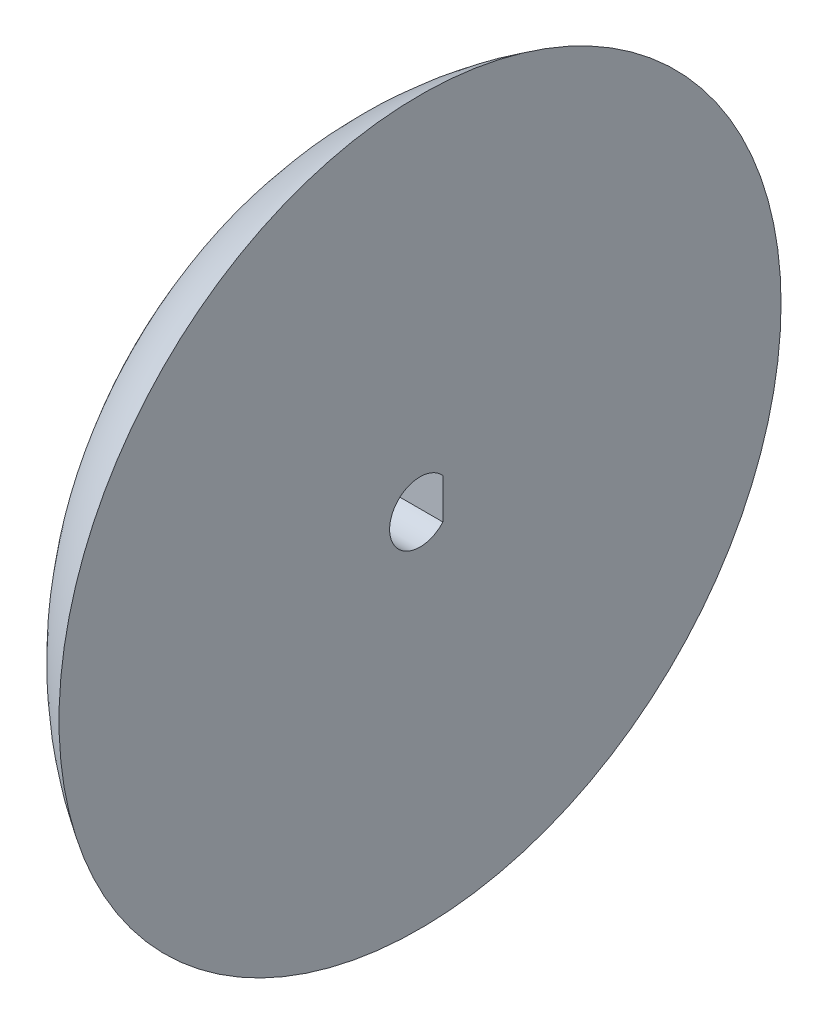
from build123d import *

# Parameters (mm, degrees)
CORTAR_EXTRUIR1_DEPTH = 7


with BuildPart() as part:
    # Croquis1 → Revolución2 (revolve)
    with BuildSketch(Plane.XY, mode=Mode.PRIVATE) as revoluci_n2_sk:
        with BuildLine():
            Line((3.350757259, 2.215456264), (-4.351379709, 2.215456264))
            Line((-4.351379709, 2.215456264), (-4.351379709, 7.514622195))
            ThreePointArc((-4.351379709, 7.514622195), (-2.293506672, 15.364277967), (3.350757259, 21.194734369))
            Line((3.350757259, 21.194734369), (3.350757259, 2.215456264))
        make_face()
    revolve(revoluci_n2_sk.sketch.rotate(Axis((3.350757259, 2.215456264, 0), (-1, 0, 0)), 90), axis=Axis((3.350757259, 2.215456264, 0), (-1, 0, 0)))

    # Croquis2 → Cortar-Extruir1 (cut)
    with BuildSketch(Plane(origin=(3.350757259, 0, 0), x_dir=(0, 0, -1), z_dir=(1, 0, 0))):
        with BuildLine():
            Line((1.2, 3.273756788), (1.2, 1.157155739))
            ThreePointArc((1.2, 1.157155739), (-1.6, 2.215456264), (1.2, 3.273756788))
        make_face()
    extrude(amount=-CORTAR_EXTRUIR1_DEPTH, mode=Mode.SUBTRACT)


solid = part.part
